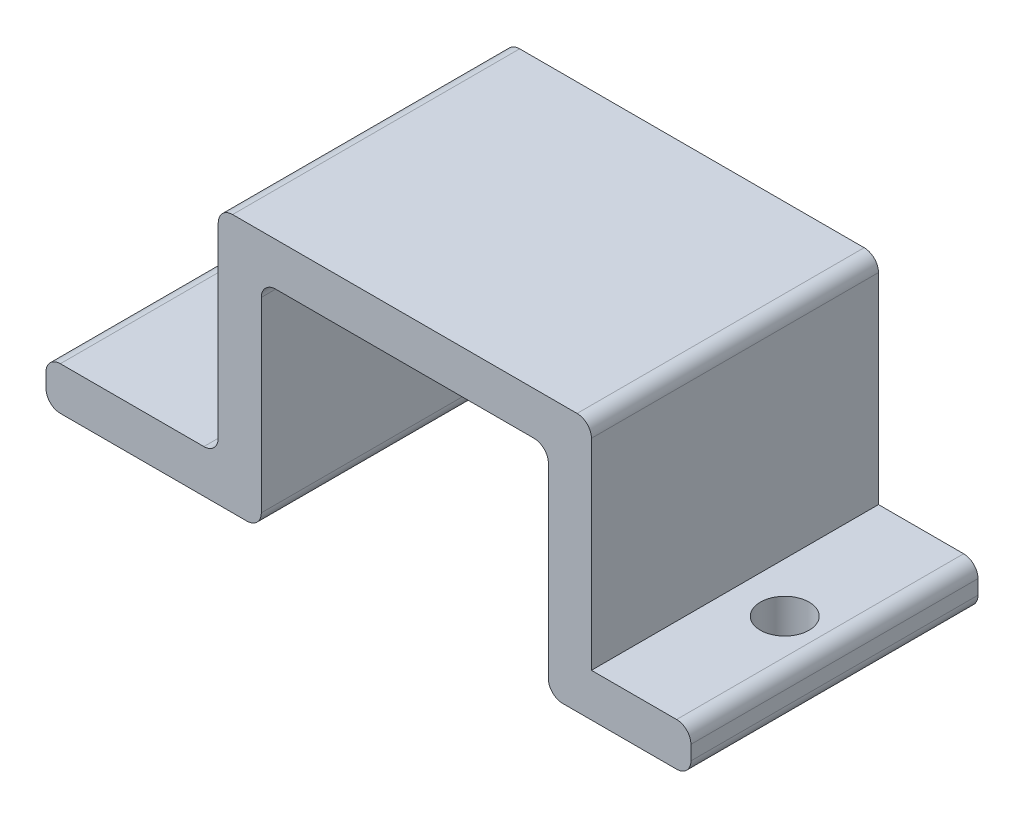
from build123d import *

# Parameters (mm, degrees)
BOSS_EXTRUDE1_DEPTH  = 20
SKETCH7_W            = 12
SKETCH7_H            = 20
SKETCH7_W_2          = 6.931673433
BOSS_EXTRUDE2_DEPTH  = 3
M3_CLEARANCE_HOLE2_D = 3.4
FILLET1_R            = 1


with BuildPart() as part:
    # Sketch3 → Boss-Extrude1 (new body)
    with BuildSketch(Plane.XY):
        Polygon((3, 0), (3, 15), (23, 15), (23, 0), (26, 0), (26, 18), (0, 18), (0, 0), align=None)
    extrude(amount=BOSS_EXTRUDE1_DEPTH)

    # Sketch7 → Boss-Extrude2 (add)
    with BuildSketch(Plane(origin=(0, 0, 0), x_dir=(1, 0, 0), z_dir=(0, 1, 0))):
        with Locations((-6, -10)):
            Rectangle(SKETCH7_W, SKETCH7_H)
        with Locations((29.465836717, -10)):
            Rectangle(SKETCH7_W_2, SKETCH7_H)
    extrude(amount=BOSS_EXTRUDE2_DEPTH)

    # M3 Clearance Hole2 (through all)
    with Locations(Plane(origin=(0, 3, 0), x_dir=(1, 0, 0), z_dir=(0, 1, 0))):
        with Locations((29.465836717, -10), (-6, -10)):
            Hole(M3_CLEARANCE_HOLE2_D / 2)

    # Fillet1
    fillet1_edges = [part.edges().sort_by_distance(p)[0] for p in [
        (0, 18, 10),
        (26, 18, 10),
        (23, 0, 10),
        (23, 15, 10),
        (3, 15, 10),
        (3, 0, 10),
        (32.931673433, 0, 10),
        (32.931673433, 3, 10),
        (-12, 0, 10),
        (0, 3, 10),
        (-12, 3, 10),
    ]]
    fillet(fillet1_edges, radius=FILLET1_R)


solid = part.part
